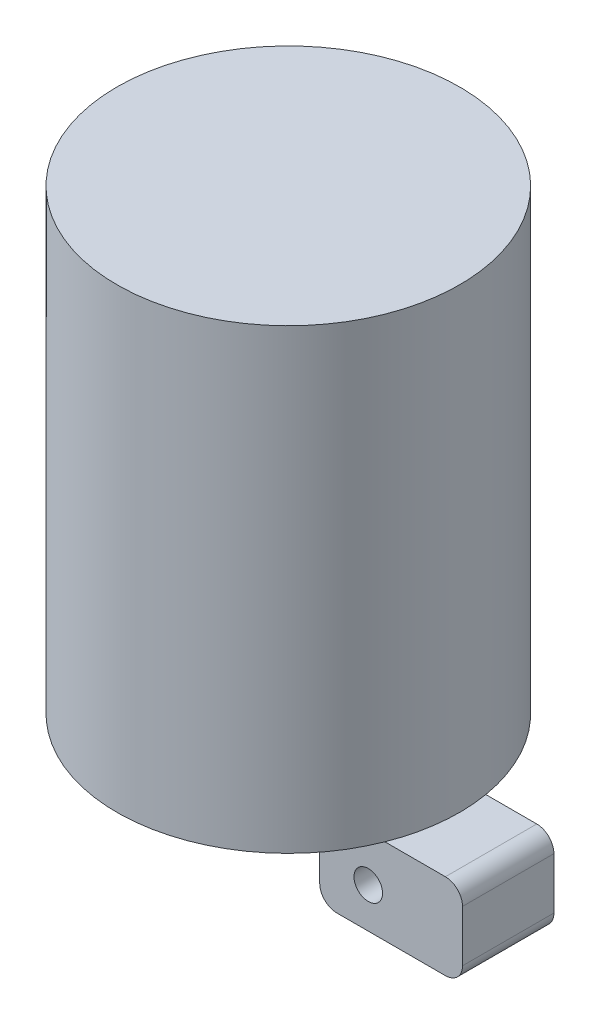
from build123d import *

# Parameters (mm, degrees)
BOSS_EXTRUDE5_DEPTH      = 11
BOSS_EXTRUDE5_DEPTH_BACK = 5
SKETCH2_R                = 2.5


with BuildPart() as part:
    # Sketch1 → Revolve1 (revolve)
    with BuildSketch(Plane.XY, mode=Mode.PRIVATE) as revolve1_sk:
        Polygon((60, 80), (30, 80), (30, 40), (42.5, 40), (42.5, 0), (60, 0), align=None)
    revolve(revolve1_sk.sketch.rotate(Axis((30, 80, 0), (0, -1, 0)), 180), axis=Axis((30, 80, 0), (0, -1, 0)))

    # Sketch2 → Boss-Extrude5 (add, two sides: drawn at the far end of the back side and taken through both)
    with BuildSketch(Plane.XY.offset(-BOSS_EXTRUDE5_DEPTH_BACK)):
        with BuildLine():
            Line((46.5, 0), (46.5, -12))
            ThreePointArc((46.5, -12), (47.378679656, -14.121320344), (49.5, -15))
            Line((49.5, -15), (68.5, -15))
            ThreePointArc((68.5, -15), (70.621320344, -14.121320344), (71.5, -12))
            Line((71.5, -12), (71.5, -3))
            ThreePointArc((71.5, -3), (70.621320344, -0.878679656), (68.5, 0))
            Line((68.5, 0), (46.5, 0))
        make_face()
        with Locations((55, -8)):
            Circle(SKETCH2_R, mode=Mode.SUBTRACT)
    extrude(amount=BOSS_EXTRUDE5_DEPTH + BOSS_EXTRUDE5_DEPTH_BACK)


solid = part.part
